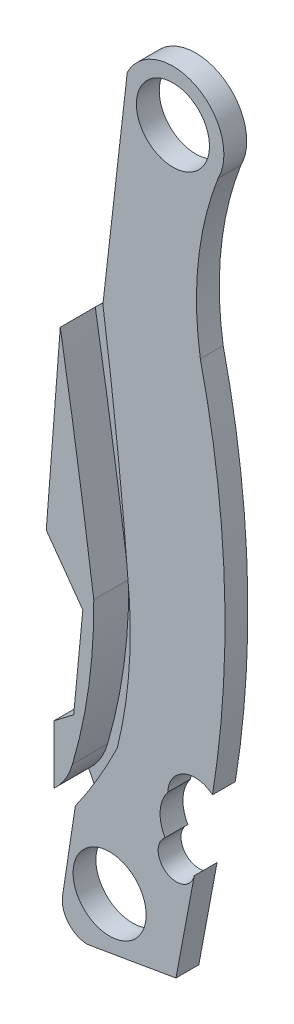
from build123d import *

# Parameters (mm, degrees)
SKETCH1_R           = 3.048
BOSS_EXTRUDE1_DEPTH = 1.905
CUT_EXTRUDE1_DEPTH  = 1.651
BOSS_EXTRUDE2_START = 1.27
BOSS_EXTRUDE2_DEPTH = 1.27


with BuildPart() as part:
    # Sketch1 → Boss-Extrude1 (new body)
    with BuildSketch(Plane.XY):
        with BuildLine():
            Line((-5.49275, -17.49425), (-5.49275, -22.42185))
            Line((-5.49275, -22.42185), (-4.90855, -23.59025))
            Line((-4.90855, -23.59025), (-6.02615, -30.95625))
            ThreePointArc((-6.02615, -30.95625), (-5.598504604, -32.704973448), (-3.99415, -33.52165))
            ThreePointArc((-3.99415, -33.52165), (-0.284785682, -32.892281616), (3.42265, -32.25165))
            Line((3.42265, -32.25165), (4.94665, -24.09825))
            ThreePointArc((4.94665, -24.09825), (2.651841734, -25.057223226), (2.50825, -22.57425))
            ThreePointArc((2.50825, -22.57425), (2.10181036, -20.83747495), (2.73685, -19.17065))
            ThreePointArc((2.73685, -19.17065), (4.08470653, -17.176398636), (6.47065, -17.49425))
            ThreePointArc((6.47065, -17.49425), (7.46828342, -1.95088497), (5.45465, 13.49375))
            ThreePointArc((5.45465, 13.49375), (5.282315002, 20.474416107), (6.92785, 27.26055))
            ThreePointArc((6.92785, 27.26055), (5.106547792, 33.02758949), (-0.64135, 31.14675))
            Line((-0.64135, 31.14675), (-2.67335, 13.36675))
            Line((-2.67335, 13.36675), (-4.95935, 11.20775))
            Line((-4.95935, 11.20775), (-6.12775, -4.03225))
            Line((-6.12775, -4.03225), (-3.07975, -8.27405))
            Line((-3.07975, -8.27405), (-3.84175, -16.22425))
            Line((-3.84175, -16.22425), (-5.49275, -17.49425))
        make_face()
        with Locations(Location((3.16865, 29.24175, 0), (0, 0, 180))):
            Circle(SKETCH1_R, mode=Mode.SUBTRACT)
        with Locations(Location((-2.11455, -28.94965, 0), (0, 0, 180))):
            Circle(SKETCH1_R, mode=Mode.SUBTRACT)
    extrude(amount=BOSS_EXTRUDE1_DEPTH)

    # Sketch2 → Cut-Extrude1 (cut)
    with BuildSketch(Plane.XY.offset(1.905)):
        with BuildLine():
            Line((-7.059940767, -26.71445), (-7.49935, -23.51405))
            ThreePointArc((-7.49935, -23.51405), (-5.25575534, -22.137911475), (-3.94335, -19.85645))
            ThreePointArc((-3.94335, -19.85645), (-2.580214562, -13.534333063), (-2.16535, -7.08025))
            ThreePointArc((-2.16535, -7.08025), (-3.488996471, 2.074956789), (-4.95935, 11.20775))
            Line((-4.95935, 11.20775), (-2.67335, 13.36675))
            ThreePointArc((-2.67335, 13.36675), (-1.409957084, 3.210909205), (-0.455940767, -6.97865))
            ThreePointArc((-0.455940767, -6.97865), (-0.544530874, -12.566939921), (-1.471940767, -18.07845))
            ThreePointArc((-1.471940767, -18.07845), (-3.99586421, -22.571205419), (-7.059940767, -26.71445))
        make_face()
    extrude(amount=-CUT_EXTRUDE1_DEPTH, mode=Mode.SUBTRACT)

    # Sketch3 → Boss-Extrude2 (add)
    with BuildSketch(Plane.XY.offset(1.905).offset(BOSS_EXTRUDE2_START)):
        with BuildLine():
            Line((-5.49275, -17.49425), (-5.49275, -22.367063276))
            ThreePointArc((-5.49275, -22.367063276), (-4.541021091, -21.221008268), (-3.94335, -19.85645))
            ThreePointArc((-3.94335, -19.85645), (-2.580214562, -13.534333063), (-2.16535, -7.08025))
            ThreePointArc((-2.16535, -7.08025), (-3.488996471, 2.074956789), (-4.95935, 11.20775))
            Line((-4.95935, 11.20775), (-6.12775, -4.03225))
            Line((-6.12775, -4.03225), (-3.07975, -8.27405))
            Line((-3.07975, -8.27405), (-3.84175, -16.22425))
            Line((-3.84175, -16.22425), (-5.49275, -17.49425))
        make_face()
    extrude(amount=-BOSS_EXTRUDE2_DEPTH)


solid = part.part
